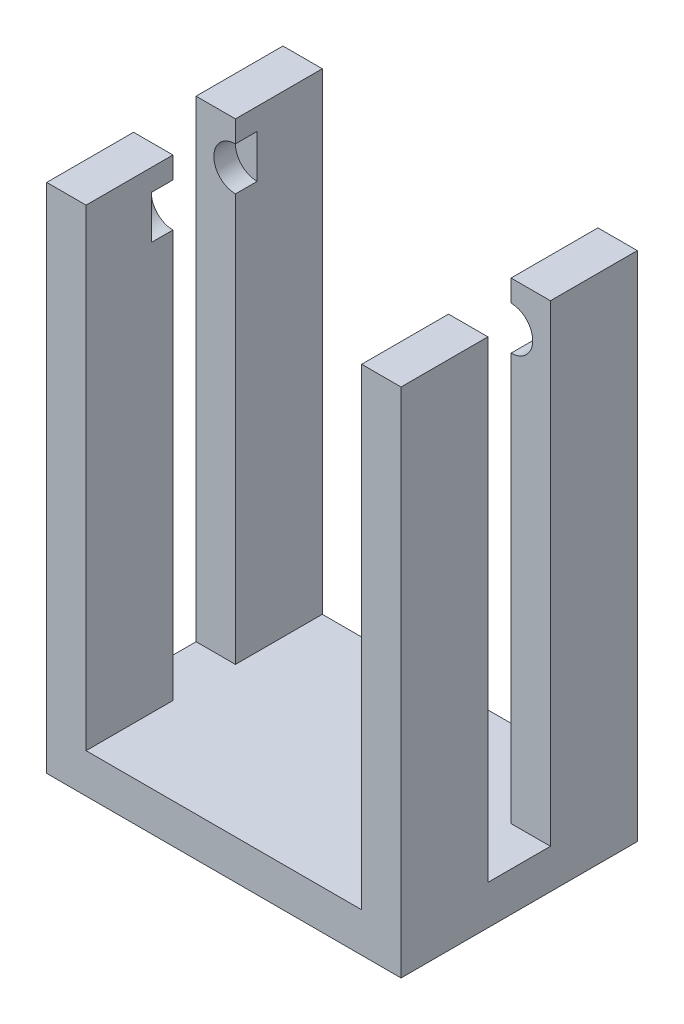
from build123d import *

# Parameters (mm, degrees)
SKETCH_1_W          = 9
SKETCH_1_H          = 6
EXTRUDE_1_DEPTH     = 1
SKETCH_2_W          = 1
SKETCH_2_H          = 2.206197562
EXTRUDE_2_DEPTH     = 12
CUT_EXTRUDE_1_DEPTH = 0.55
CUT_EXTRUDE_2_DEPTH = 0.55
CUT_EXTRUDE_3_DEPTH = 0.55
CUT_EXTRUDE_START   = -0.55
CUT_EXTRUDE_4_DEPTH = 0.55


with BuildPart() as part:
    # 草圖1 → 填料-伸長1 (new body)
    with BuildSketch(Plane(origin=(0, 0, 0), x_dir=(1, 0, 0), z_dir=(0, 1, 0))):
        Rectangle(SKETCH_1_W, SKETCH_1_H)
    extrude(amount=EXTRUDE_1_DEPTH)

    # 草圖2 → 填料-伸長2 (add)
    with BuildSketch(Plane(origin=(0, 1, 0), x_dir=(1, 0, 0), z_dir=(0, 1, 0))):
        with Locations((-4, 1.896901219)):
            Rectangle(SKETCH_2_W, SKETCH_2_H)
        with Locations((-4, -1.896901219)):
            Rectangle(SKETCH_2_W, SKETCH_2_H)
        with Locations((4, -1.896901219)):
            Rectangle(SKETCH_2_W, SKETCH_2_H)
        with Locations((4, 1.896901219)):
            Rectangle(SKETCH_2_W, SKETCH_2_H)
    extrude(amount=EXTRUDE_2_DEPTH)

    # 草圖4 → 除料-伸長1 (cut)
    with BuildSketch(Plane.XY.offset(-0.793802438)):
        with BuildLine():
            ThreePointArc((4.05, 11.897519797), (3.88890873, 12.286428527), (3.5, 12.447519797))
            Line((3.5, 12.447519797), (3.5, 11.897519797))
            Line((3.5, 11.897519797), (3.5, 11.347519797))
            ThreePointArc((3.5, 11.347519797), (3.88890873, 11.508611068), (4.05, 11.897519797))
        make_face()
        with BuildLine():
            Line((3.5, 11.897519797), (3.5, 12.447519797))
            ThreePointArc((3.5, 12.447519797), (2.95, 11.897519797), (3.5, 11.347519797))
            Line((3.5, 11.347519797), (3.5, 11.897519797))
        make_face()
    extrude(amount=-CUT_EXTRUDE_1_DEPTH, mode=Mode.SUBTRACT)

    # 草圖6 → 除料-伸長2 (cut)
    with BuildSketch(Plane(origin=(0, 0, 0.793802438), x_dir=(-1, 0, 0), z_dir=(0, 0, -1))):
        with BuildLine():
            ThreePointArc((-2.95, 11.9), (-3.11109127, 12.28890873), (-3.5, 12.45))
            Line((-3.5, 12.45), (-3.5, 11.9))
            Line((-3.5, 11.9), (-3.5, 11.35))
            ThreePointArc((-3.5, 11.35), (-3.11109127, 11.51109127), (-2.95, 11.9))
        make_face()
        with BuildLine():
            Line((-3.5, 11.9), (-3.5, 12.45))
            ThreePointArc((-3.5, 12.45), (-4.05, 11.9), (-3.5, 11.35))
            Line((-3.5, 11.35), (-3.5, 11.9))
        make_face()
    extrude(amount=-CUT_EXTRUDE_2_DEPTH, mode=Mode.SUBTRACT)

    # 草圖7 → 除料-伸長3 (cut)
    with BuildSketch(Plane(origin=(0, 0, 0.793802438), x_dir=(-1, 0, 0), z_dir=(0, 0, -1))):
        with BuildLine():
            ThreePointArc((4.05, 11.9), (3.88890873, 12.28890873), (3.5, 12.45))
            Line((3.5, 12.45), (3.5, 11.9))
            Line((3.5, 11.9), (3.5, 11.35))
            ThreePointArc((3.5, 11.35), (3.88890873, 11.51109127), (4.05, 11.9))
        make_face()
        with BuildLine():
            Line((3.5, 11.9), (3.5, 12.45))
            ThreePointArc((3.5, 12.45), (2.95, 11.9), (3.5, 11.35))
            Line((3.5, 11.35), (3.5, 11.9))
        make_face()
    extrude(amount=-CUT_EXTRUDE_3_DEPTH, mode=Mode.SUBTRACT)

    # 草圖8 → 除料-伸長4 (cut)
    with BuildSketch(Plane.XY.offset(-0.793802438).offset(CUT_EXTRUDE_START)):
        with BuildLine():
            ThreePointArc((-2.95, 11.9), (-3.11109127, 12.28890873), (-3.5, 12.45))
            Line((-3.5, 12.45), (-3.5, 11.9))
            Line((-3.5, 11.9), (-3.5, 11.35))
            ThreePointArc((-3.5, 11.35), (-3.11109127, 11.51109127), (-2.95, 11.9))
        make_face()
        with BuildLine():
            Line((-3.5, 11.9), (-3.5, 12.45))
            ThreePointArc((-3.5, 12.45), (-4.05, 11.9), (-3.5, 11.35))
            Line((-3.5, 11.35), (-3.5, 11.9))
        make_face()
    extrude(amount=CUT_EXTRUDE_4_DEPTH, mode=Mode.SUBTRACT)


solid = part.part
